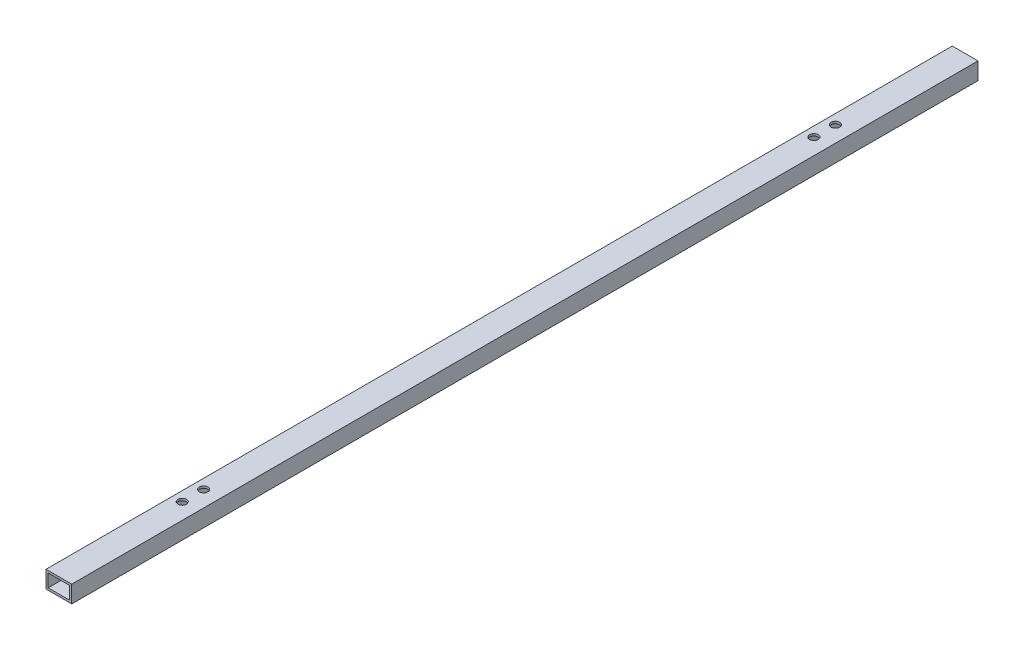
from build123d import *

# Parameters (mm, degrees)
BOSS_EXTRUDE1_DEPTH      = 670.56
BOSS_EXTRUDE1_DEPTH_BACK = 670.56
SKETCH3_W                = 38.1
SKETCH3_H                = 25.4
SKETCH3_W_2              = 31.75
SKETCH3_H_2              = 19.05
SKETCH6_R                = 6.35
CUT_EXTRUDE1_DEPTH       = 672.311236387


with BuildPart() as part:
    # Sketch3 → Boss-Extrude1 (new, two sides: drawn at the far end of the back side and taken through both)
    with BuildSketch(Plane.XY.offset(-BOSS_EXTRUDE1_DEPTH_BACK)):
        Rectangle(SKETCH3_W, SKETCH3_H)
        Rectangle(SKETCH3_W_2, SKETCH3_H_2, mode=Mode.SUBTRACT)
    extrude(amount=BOSS_EXTRUDE1_DEPTH + BOSS_EXTRUDE1_DEPTH_BACK)

    # Sketch6 → Cut-Extrude1 (cut, through all)
    with BuildSketch(Plane(origin=(0, 12.7, 0), x_dir=(1, 0, 0), z_dir=(0, 1, 0))):
        with Locations(Location((-4.7625, -451.485, 0), (0, 0, 270))):
            Circle(SKETCH6_R)
        with Locations(Location((-4.7625, -483.235, 0), (0, 0, 270))):
            Circle(SKETCH6_R)
        with Locations(Location((-4.7625, 483.235, 0), (0, 0, 270))):
            Circle(SKETCH6_R)
        with Locations(Location((-4.7625, 451.485, 0), (0, 0, 270))):
            Circle(SKETCH6_R)
    extrude(amount=-CUT_EXTRUDE1_DEPTH, mode=Mode.SUBTRACT)


solid = part.part
